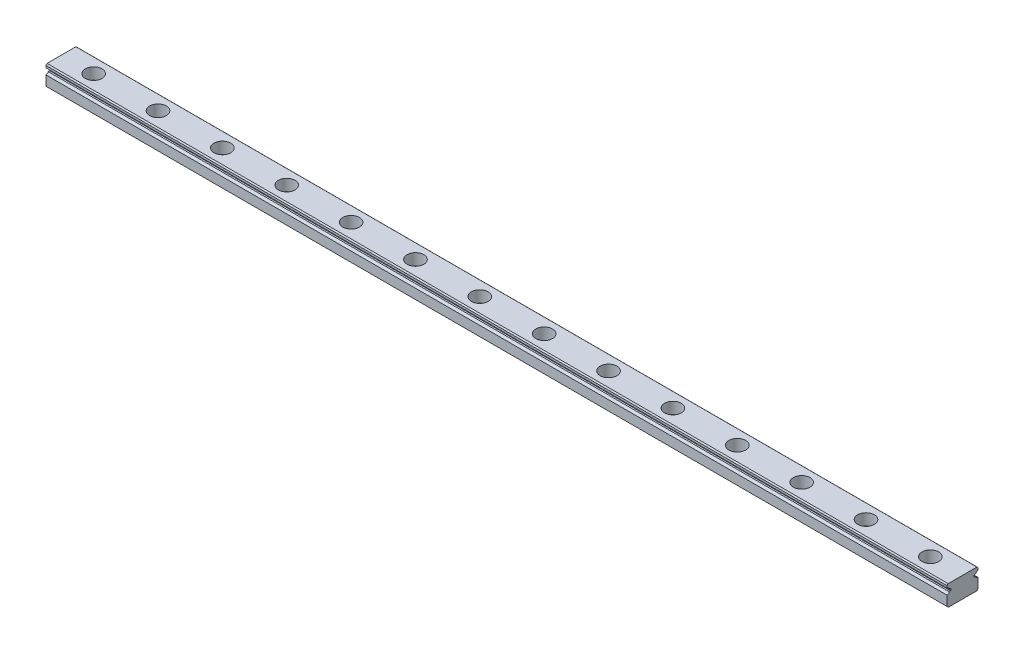
from build123d import *

# Parameters (mm, degrees)
EXTRUDE1_DEPTH  = 350
SKETCH8_R       = 0.5
EXTRUDE2_DEPTH  = 150
LPATTERN1_COUNT = 13
LPATTERN1_PITCH = 25


with BuildPart() as part:
    # Sketch1 → Extrude1 (new body)
    with BuildSketch(Plane(origin=(0, 0, 0), x_dir=(0, 0, -1), z_dir=(1, 0, 0))):
        with BuildLine():
            Line((-6, 0.5), (-5.5, 0))
            Line((-5.5, 0), (5.5, 0))
            Line((5.5, 0), (6, 0.5))
            Line((6, 0.5), (6, 4.316784043))
            ThreePointArc((6, 4.316784043), (5.473240049, 4.54510735), (5.1128312, 4.992))
            Line((5.1128312, 4.992), (4.622, 5.078546784))
            ThreePointArc((4.622, 5.078546784), (4.552906648, 5.14064182), (4.5, 5.217))
            Line((4.5, 5.217), (4.5, 5.783))
            ThreePointArc((4.5, 5.783), (4.552906648, 5.85935818), (4.622, 5.921453216))
            Line((4.622, 5.921453216), (5.1128312, 6.008))
            ThreePointArc((5.1128312, 6.008), (5.473240049, 6.45489265), (6, 6.683215957))
            Line((6, 6.683215957), (6, 7.5))
            ThreePointArc((6, 7.5), (5.841101212, 7.78288097), (5.6, 8))
            Line((5.6, 8), (-5.6, 8))
            ThreePointArc((-5.6, 8), (-5.841101212, 7.78288097), (-6, 7.5))
            Line((-6, 7.5), (-6, 6.683215957))
            ThreePointArc((-6, 6.683215957), (-5.473240049, 6.45489265), (-5.1128312, 6.008))
            Line((-5.1128312, 6.008), (-4.622, 5.921453216))
            ThreePointArc((-4.622, 5.921453216), (-4.552906648, 5.85935818), (-4.5, 5.783))
            Line((-4.5, 5.783), (-4.5, 5.217))
            ThreePointArc((-4.5, 5.217), (-4.552906648, 5.14064182), (-4.622, 5.078546784))
            Line((-4.622, 5.078546784), (-5.1128312, 4.992))
            ThreePointArc((-5.1128312, 4.992), (-5.473240049, 4.54510735), (-6, 4.316784043))
            Line((-6, 4.316784043), (-6, 0.5))
        make_face()
    extrude(amount=EXTRUDE1_DEPTH)

    # Sketch2 → Cut-Revolve1 (revolve, cut)
    with BuildSketch(Plane(origin=(0, 0, 0), x_dir=(-1, 0, 0), z_dir=(0, 0, -1))):
        Polygon((-12.5, 8), (-9.25, 8), (-9.25, 3.5), (-10.75, 3.5), (-10.75, 0.2), (-10.55, 0), (-12.5, 0), align=None)
    revolve(axis=Axis((12.5, 0, 0), (0, 1, 0)), mode=Mode.SUBTRACT)

    # Sketch3 → Cut-Revolve2 (revolve, cut)
    with BuildSketch(Plane(origin=(125, 0, 0), x_dir=(-1, 0, 0), z_dir=(0, 0, -1))):
        Polygon((-212.5, 8), (-209.25, 8), (-209.25, 3.5), (-210.75, 3.5), (-210.75, 0.2), (-210.55, 0), (-212.5, 0), align=None)
    cut_revolve2 = revolve(axis=Axis((337.5, 0, 0), (0, 1, 0)), mode=Mode.SUBTRACT)

    # Sketch8 → Extrude2 (cut)
    with BuildSketch(Plane(origin=(0, 0, 0), x_dir=(0, 0, -1), z_dir=(1, 0, 0))):
        with Locations((3.5, -0.3)):
            Circle(SKETCH8_R)
    extrude(amount=EXTRUDE2_DEPTH, mode=Mode.SUBTRACT)

    # LPattern1: Cut-Revolve2 ×13
    with Locations(*[(-i * LPATTERN1_PITCH, 0, 0) for i in range(1, LPATTERN1_COUNT)]):
        add(cut_revolve2, mode=Mode.SUBTRACT)


solid = part.part
